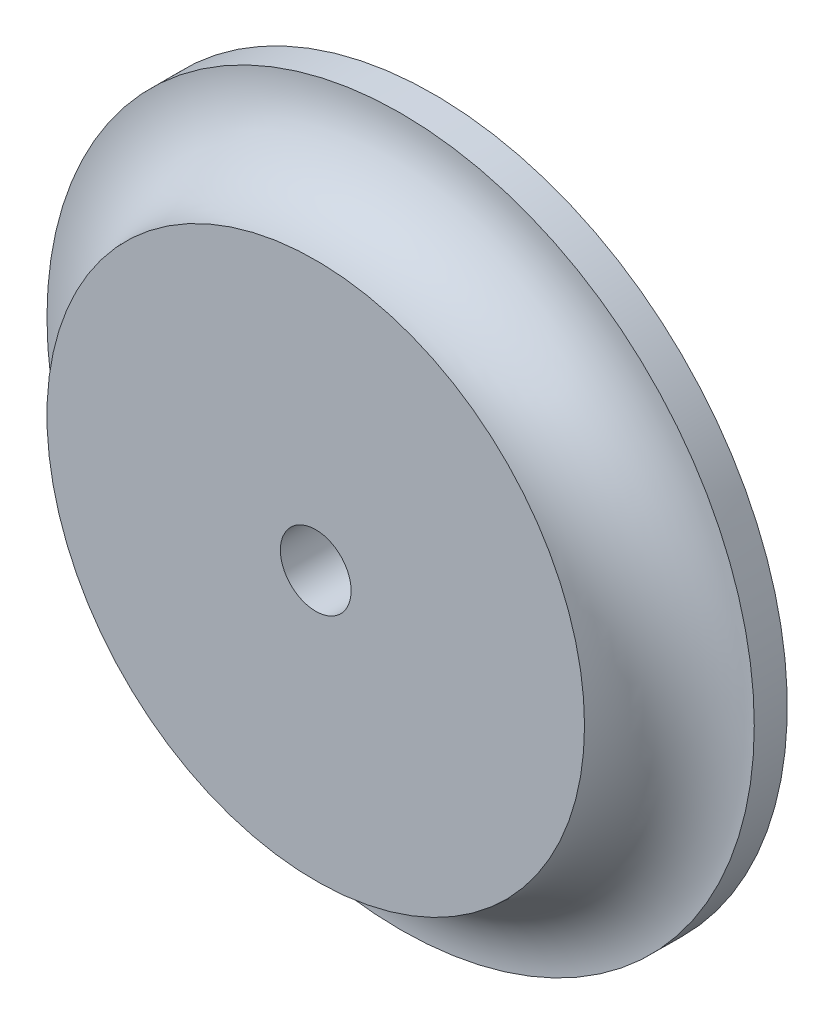
from build123d import *

# Parameters (mm, degrees)
SKETCH9_R                  = 38.1
BOSS_EXTRUDE2_DEPTH        = 3.556
BOSS_EXTRUDE3_START        = 3.556
SKETCH10_R                 = 38.1
BOSS_EXTRUDE3_DEPTH        = 3.556
F_3_4_0_3_DIAMETER_HOLE1_D = 7.62
CUT_EXTRUDE1_DEPTH         = 59.141038312
CUT_EXTRUDE1_DEPTH_BACK    = 59.141038312
SKETCH16_W                 = 76.2
SKETCH16_H                 = 12.7


with BuildPart() as part:
    # Sketch5 → Revolve1 (revolve)
    with BuildSketch(Plane(origin=(0, 0, 0), x_dir=(1, 0, 0), z_dir=(0, 1, 0)), mode=Mode.PRIVATE) as revolve1_sk:
        with BuildLine():
            Line((0, 0), (-38.1, 0))
            ThreePointArc((-38.1, 0), (-28.956, 9.144), (-38.1, 18.288))
            Line((-38.1, 18.288), (0, 18.288))
            Line((0, 18.288), (0, 0))
        make_face()
    revolve(revolve1_sk.sketch.rotate(Axis((0, 0, 0), (0, 0, -1)), 180), axis=Axis((0, 0, 0), (0, 0, -1)))

    # Sketch9 → Boss-Extrude2 (add)
    with BuildSketch(Plane.XY):
        Circle(SKETCH9_R)
    extrude(amount=BOSS_EXTRUDE2_DEPTH)

    # Sketch10 → Boss-Extrude3 (add)
    with BuildSketch(Plane(origin=(0, 0, -18.288), x_dir=(-1, 0, 0), z_dir=(0, 0, -1)).offset(BOSS_EXTRUDE3_START)):
        with Locations(Location((0, 0, 0), (0, 0, 180))):
            Circle(SKETCH10_R)
    extrude(amount=-BOSS_EXTRUDE3_DEPTH)

    # 3/4 (0.3) Diameter Hole1 (through all)
    with Locations(Plane.XY.offset(3.556)):
        with Locations((0, 0)):
            Hole(F_3_4_0_3_DIAMETER_HOLE1_D / 2)

    # Sketch16 → Cut-Extrude1 (cut, two sides: drawn at the far end of the back side and taken through both)
    with BuildSketch(Plane(origin=(0, 0, 0), x_dir=(1, 0, 0), z_dir=(0, 1, 0)).offset(-CUT_EXTRUDE1_DEPTH_BACK)):
        with Locations((0, 2.794)):
            Rectangle(SKETCH16_W, SKETCH16_H)
    extrude(amount=CUT_EXTRUDE1_DEPTH + CUT_EXTRUDE1_DEPTH_BACK, mode=Mode.SUBTRACT)


solid = part.part
